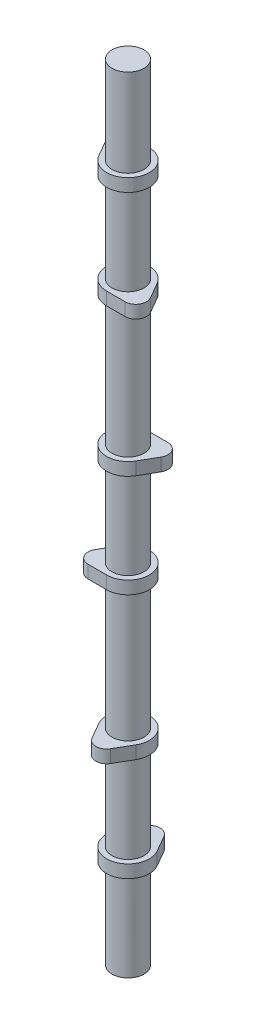
from build123d import *

# Parameters (mm, degrees)
BOSS_EXTRUDE4_DEPTH   = 7.62
BODY_MOVE_COPY4_ANGLE = 180
BOSS_EXTRUDE5_START   = -25.4
SKETCH2_R             = 9.5
BOSS_EXTRUDE5_DEPTH   = 146.02
LPATTERN1_COUNT       = 3
LPATTERN1_PITCH       = 146.02
BODY_MOVE_COPY5_ANGLE = 120
BODY_MOVE_COPY6_ANGLE = 120
BOSS_EXTRUDE6_START   = 27.92
SKETCH4_R             = 9.5
BOSS_EXTRUDE6_DEPTH   = 27.92


with BuildPart() as part:
    # Sketch1 → Boss-Extrude4 (new body)
    with BuildSketch(Plane(origin=(0, 0, 0), x_dir=(1, 0, 0), z_dir=(0, 1, 0))):
        with BuildLine():
            Line((-5.499261314, 15.875), (-10.998522628, 6.35))
            ThreePointArc((-10.998522628, 6.35), (0, -12.7), (10.998522628, 6.35))
            Line((10.998522628, 6.35), (5.499261314, 15.875))
            ThreePointArc((5.499261314, 15.875), (0, 19.05), (-5.499261314, 15.875))
        make_face()
    extrude(amount=BOSS_EXTRUDE4_DEPTH)


with BuildPart() as body_2:
    # Body-Move/Copy3: copy of part
    add(part.part.moved(Location((0, 60.96, 0))))


with BuildPart() as body_2_1:
    # Body-Move/Copy4: moved
    add(body_2.part.rotate(Axis((0, 0, 0), (0, 1, 0)), BODY_MOVE_COPY4_ANGLE))


with BuildPart() as part_1:
    add(part.part)

    add(body_2_1.part)  # Boss-Extrude5 merges body 2
    # Sketch2 → Boss-Extrude5 (add)
    with BuildSketch(Plane(origin=(0, 0, 0), x_dir=(1, 0, 0), z_dir=(0, 1, 0)).offset(BOSS_EXTRUDE5_START)):
        Circle(SKETCH2_R)
    extrude(amount=BOSS_EXTRUDE5_DEPTH)


with BuildPart() as lpattern1_1:
    # LPattern1: pattern copy
    add(part_1.part.moved(Location(Vector(0, 1, 0) * (1 * LPATTERN1_PITCH))))


with BuildPart() as lpattern1_2:
    # LPattern1: pattern copy
    add(part_1.part.moved(Location(Vector(0, 1, 0) * (2 * LPATTERN1_PITCH))))


with BuildPart() as lpattern1_1_1:
    # Body-Move/Copy5: moved
    add(lpattern1_1.part.rotate(Axis((0, 0, 0), (0, 1, 0)), BODY_MOVE_COPY5_ANGLE))


with BuildPart() as lpattern1_2_1:
    # Body-Move/Copy6: moved
    add(lpattern1_2.part.rotate(Axis((0, 0, 0), (0, -1, 0)), BODY_MOVE_COPY6_ANGLE))


with BuildPart() as part_2:
    add(part_1.part)

    # Sketch4 → Boss-Extrude6 (add)
    with BuildSketch(Plane.XZ.offset(25.4).offset(BOSS_EXTRUDE6_START)):
        Circle(SKETCH4_R)
    extrude(amount=-BOSS_EXTRUDE6_DEPTH)


with BuildPart() as lpattern1_2_2:
    add(lpattern1_2_1.part)

    # Combine1: union LPattern1_1, part
    add(lpattern1_1_1.part)
    add(part_2.part)


solid = lpattern1_2_2.part
